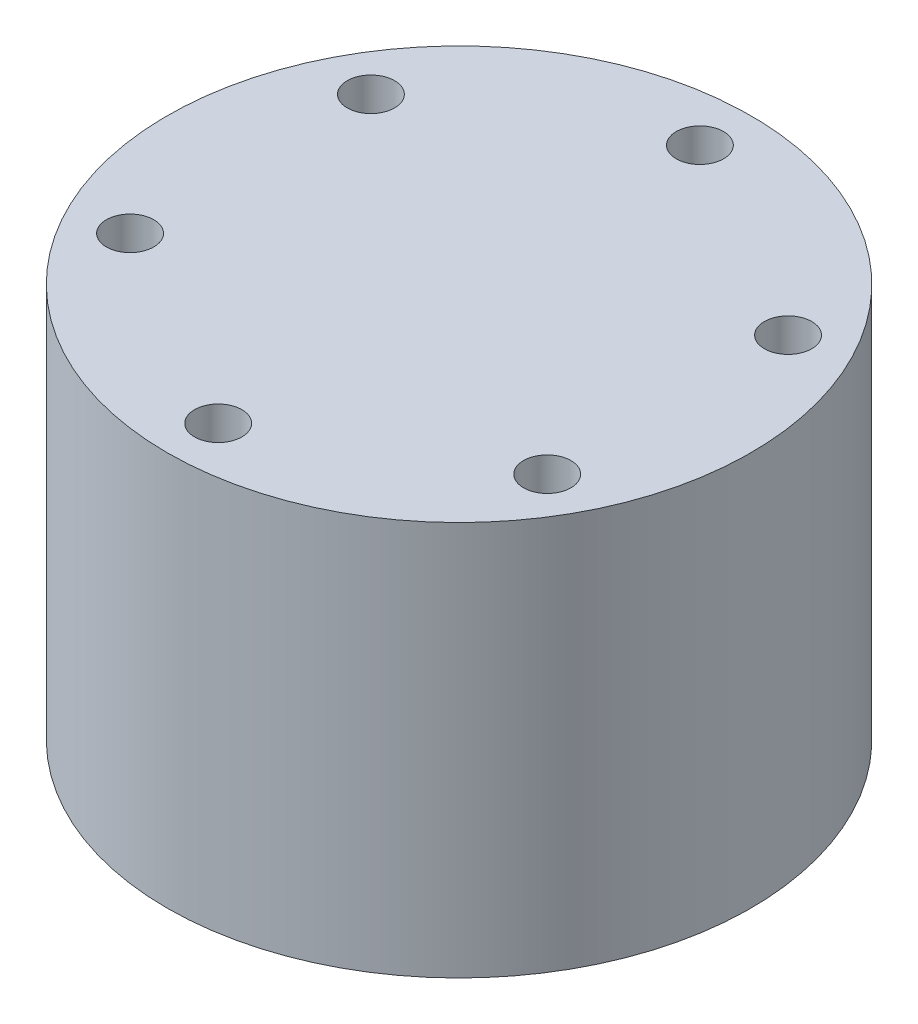
from build123d import *

# Parameters (mm, degrees)
SKETCH1_R           = 18.5
BOSS_EXTRUDE1_DEPTH = 25
SKETCH2_R           = 1.5
CUT_EXTRUDE1_DEPTH  = 10


with BuildPart() as part:
    # Sketch1 → Boss-Extrude1 (new body)
    with BuildSketch(Plane(origin=(0, 0, 0), x_dir=(1, 0, 0), z_dir=(0, 1, 0))):
        with Locations(Location((0, 0, 0), (0, 0, 270))):
            Circle(SKETCH1_R)
    extrude(amount=BOSS_EXTRUDE1_DEPTH)

    # Sketch2 → Cut-Extrude1 (cut)
    with BuildSketch(Plane(origin=(0, 25, 0), x_dir=(1, 0, 0), z_dir=(0, 1, 0))):
        with Locations(Location((0, 15.265, 0), (0, 0, 270))):
            Circle(SKETCH2_R)
        with Locations(Location((13.219877789, 7.6325, 0), (0, 0, 270))):
            Circle(SKETCH2_R)
        with Locations(Location((13.219877789, -7.6325, 0), (0, 0, 270))):
            Circle(SKETCH2_R)
        with Locations(Location((0, -15.265, 0), (0, 0, 270))):
            Circle(SKETCH2_R)
        with Locations(Location((-13.219877789, -7.6325, 0), (0, 0, 270))):
            Circle(SKETCH2_R)
        with Locations(Location((-13.219877789, 7.6325, 0), (0, 0, 270))):
            Circle(SKETCH2_R)
    extrude(amount=-CUT_EXTRUDE1_DEPTH, mode=Mode.SUBTRACT)


solid = part.part
